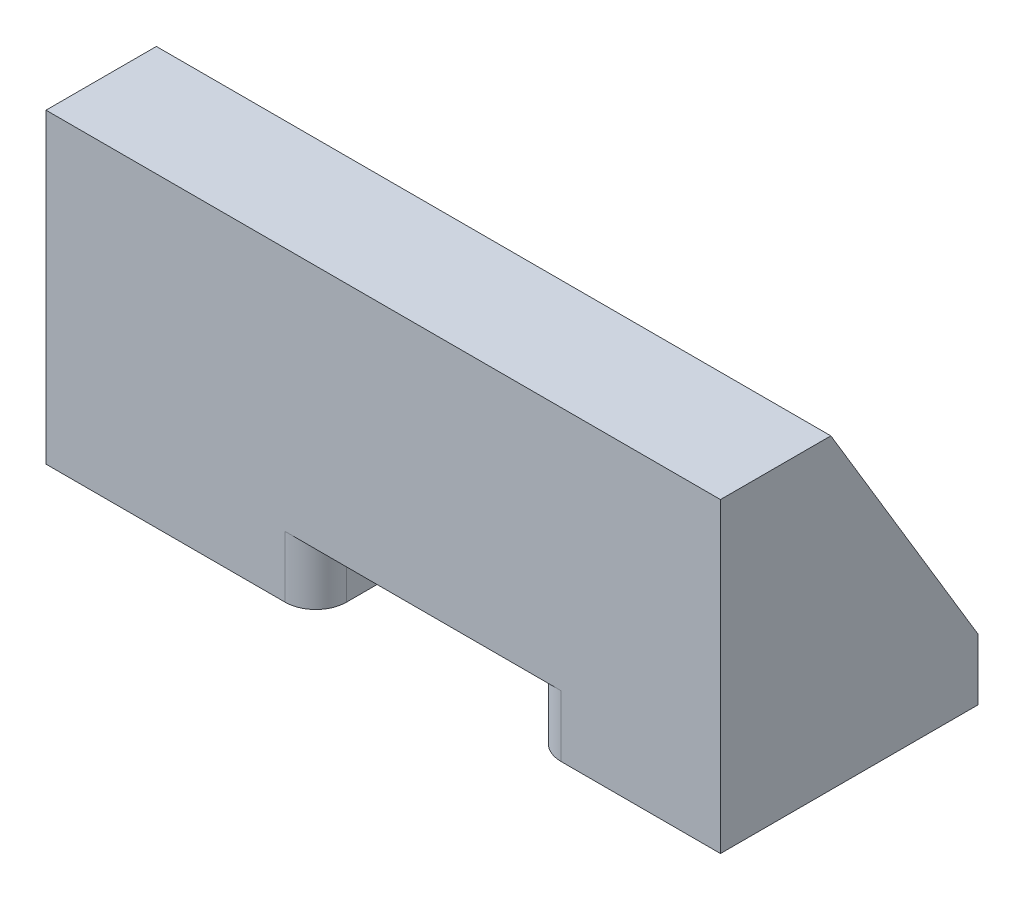
from build123d import *

# Parameters (mm, degrees)
SKETCH1_W                       = 110
SKETCH1_H                       = 42
BOSS_EXTRUDE1_DEPTH             = 10
CBORE_FOR_M3_SBHCS1_D           = 3.4
CBORE_FOR_M3_SBHCS1_CBORE_D     = 8
CBORE_FOR_M3_SBHCS1_CBORE_DEPTH = 5
CUT_EXTRUDE1_DEPTH              = 10
FILLET2_R                       = 5
SKETCH6_W                       = 110
SKETCH6_H                       = 18
BOSS_EXTRUDE2_DEPTH             = 40
BOSS_EXTRUDE3_DEPTH             = 5
BOSS_EXTRUDE4_DEPTH             = 5
SKETCH10_W                      = 35
SKETCH10_H                      = 13
CUT_EXTRUDE2_DEPTH              = 15
FILLET3_R                       = 5


with BuildPart() as part:
    # Sketch1 → Boss-Extrude1 (new body)
    with BuildSketch(Plane(origin=(0, 0, 0), x_dir=(1, 0, 0), z_dir=(0, 1, 0))):
        Rectangle(SKETCH1_W, SKETCH1_H)
    extrude(amount=BOSS_EXTRUDE1_DEPTH)

    # CBORE for M3 SBHCS1 (through all)
    with Locations(Plane(origin=(0, 10, 0), x_dir=(1, 0, 0), z_dir=(0, 1, 0))):
        with Locations((-45, 8), (-32, 3), (32, 3), (45, 8)):
            CounterBoreHole(CBORE_FOR_M3_SBHCS1_D / 2, CBORE_FOR_M3_SBHCS1_CBORE_D / 2, CBORE_FOR_M3_SBHCS1_CBORE_DEPTH)

    # Sketch4 → Cut-Extrude1 (cut)
    with BuildSketch(Plane(origin=(0, 10, 0), x_dir=(1, 0, 0), z_dir=(0, 1, 0))):
        with BuildLine():
            Line((24, -21), (24, 6))
            ThreePointArc((24, 6), (22.535533906, 9.535533906), (19, 11))
            Line((19, 11), (-6, 11))
            ThreePointArc((-6, 11), (-9.535533906, 9.535533906), (-11, 6))
            Line((-11, 6), (-11, -21))
            Line((-11, -21), (24, -21))
        make_face()
    extrude(amount=-CUT_EXTRUDE1_DEPTH, mode=Mode.SUBTRACT)

    # Fillet2
    fillet2_edges = [part.edges().sort_by_distance(p)[0] for p in [
        (-11, 5, 21),
        (24, 5, 21),
    ]]
    fillet(fillet2_edges, radius=FILLET2_R)

    # Sketch6 → Boss-Extrude2 (add)
    with BuildSketch(Plane(origin=(0, 10, 0), x_dir=(1, 0, 0), z_dir=(0, 1, 0))):
        with Locations((0, -12)):
            Rectangle(SKETCH6_W, SKETCH6_H)
    extrude(amount=BOSS_EXTRUDE2_DEPTH)

    # Sketch8 → Boss-Extrude3 (add)
    with BuildSketch(Plane.ZY.offset(55)):
        Polygon((-21, 10), (3, 10), (3, 50), align=None)
    extrude(amount=-BOSS_EXTRUDE3_DEPTH)

    # Sketch9 → Boss-Extrude4 (add)
    with BuildSketch(Plane(origin=(55, 0, 0), x_dir=(0, 0, -1), z_dir=(1, 0, 0))):
        Polygon((-3, 10), (21, 10), (-3, 50), align=None)
    extrude(amount=-BOSS_EXTRUDE4_DEPTH)

    # Sketch10 → Cut-Extrude2 (cut)
    with BuildSketch(Plane.XZ.offset(-10)):
        with Locations((6.5, 9.5)):
            Rectangle(SKETCH10_W, SKETCH10_H)
    extrude(amount=-CUT_EXTRUDE2_DEPTH, mode=Mode.SUBTRACT)

    # Fillet3
    fillet3_edges = [part.edges().sort_by_distance(p)[0] for p in [
        (24, 17.5, 3),
        (6.5, 25, 3),
        (-11, 17.5, 3),
    ]]
    fillet(fillet3_edges, radius=FILLET3_R)


solid = part.part
